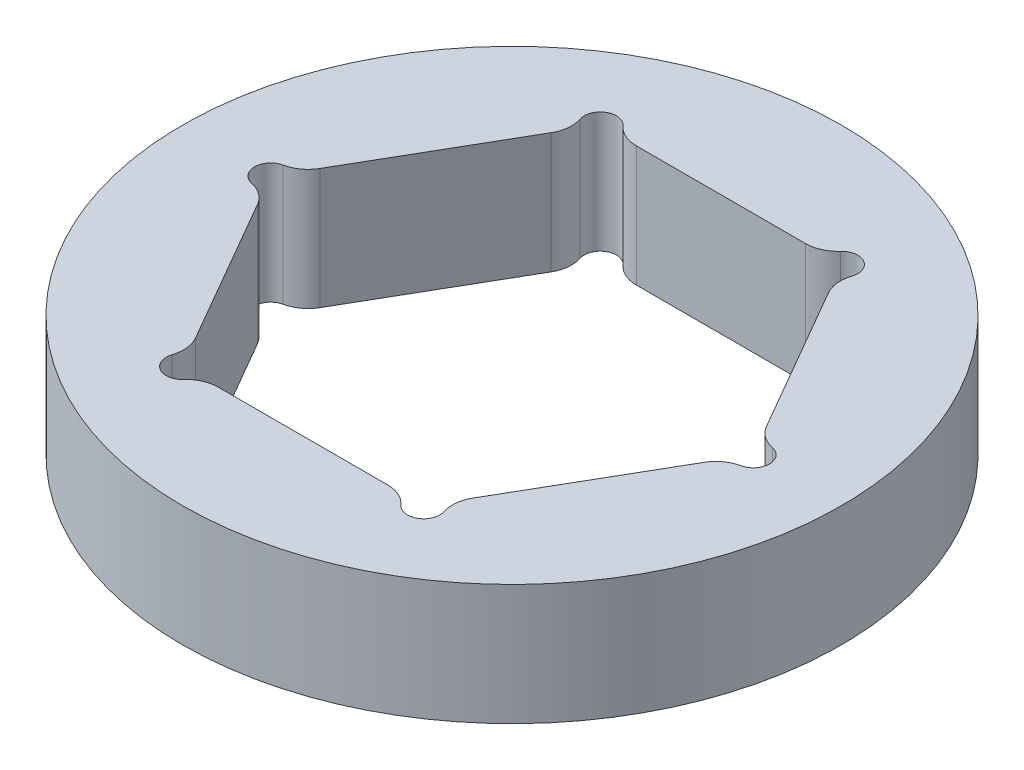
from build123d import *

# Parameters (mm, degrees)
CROQUIS1_R              = 4.1
SALIENTE_EXTRUIR1_DEPTH = 0.75


with BuildPart() as part:
    # Croquis1 → Saliente-Extruir1 (new, symmetric)
    with BuildSketch(Plane(origin=(0, 0, 0), x_dir=(1, 0, 0), z_dir=(0, 1, 0))):
        with Locations(Location((0, 0, 0), (0, 0, 270))):
            Circle(CROQUIS1_R)
        with BuildLine():
            Line((1.724717498, -2.212701665), (2.778614602, -0.387298335))
            ThreePointArc((2.778614602, -0.387298335), (2.890446656, -0.263302793), (3.043155854, -0.195766112))
            ThreePointArc((3.043155854, -0.195766112), (3.2022214, 0), (3.043155854, 0.195766112))
            ThreePointArc((3.043155854, 0.195766112), (2.890446656, 0.263302793), (2.778614602, 0.387298335))
            Line((2.778614602, 0.387298335), (1.724717498, 2.212701665))
            ThreePointArc((1.724717498, 2.212701665), (1.673250235, 2.371548836), (1.691116353, 2.537567222))
            ThreePointArc((1.691116353, 2.537567222), (1.6011107, 2.773205081), (1.352039501, 2.733333333))
            ThreePointArc((1.352039501, 2.733333333), (1.217196421, 2.634851628), (1.053897104, 2.6))
            Line((1.053897104, 2.6), (-1.053897104, 2.6))
            ThreePointArc((-1.053897104, 2.6), (-1.217196421, 2.634851628), (-1.352039501, 2.733333333))
            ThreePointArc((-1.352039501, 2.733333333), (-1.6011107, 2.773205081), (-1.691116353, 2.537567222))
            ThreePointArc((-1.691116353, 2.537567222), (-1.673250235, 2.371548836), (-1.724717498, 2.212701665))
            Line((-1.724717498, 2.212701665), (-2.778614602, 0.387298335))
            ThreePointArc((-2.778614602, 0.387298335), (-2.890446656, 0.263302793), (-3.043155854, 0.195766112))
            ThreePointArc((-3.043155854, 0.195766112), (-3.2022214, 0), (-3.043155854, -0.195766112))
            ThreePointArc((-3.043155854, -0.195766112), (-2.890446656, -0.263302793), (-2.778614602, -0.387298335))
            Line((-2.778614602, -0.387298335), (-1.724717498, -2.212701665))
            ThreePointArc((-1.724717498, -2.212701665), (-1.673250235, -2.371548836), (-1.691116353, -2.537567222))
            ThreePointArc((-1.691116353, -2.537567222), (-1.6011107, -2.773205081), (-1.352039501, -2.733333333))
            ThreePointArc((-1.352039501, -2.733333333), (-1.217196421, -2.634851628), (-1.053897104, -2.6))
            Line((-1.053897104, -2.6), (1.053897104, -2.6))
            ThreePointArc((1.053897104, -2.6), (1.217196421, -2.634851628), (1.352039501, -2.733333333))
            ThreePointArc((1.352039501, -2.733333333), (1.6011107, -2.773205081), (1.691116353, -2.537567222))
            ThreePointArc((1.691116353, -2.537567222), (1.673250235, -2.371548836), (1.724717498, -2.212701665))
        make_face(mode=Mode.SUBTRACT)
    extrude(amount=SALIENTE_EXTRUIR1_DEPTH, both=True)


solid = part.part
